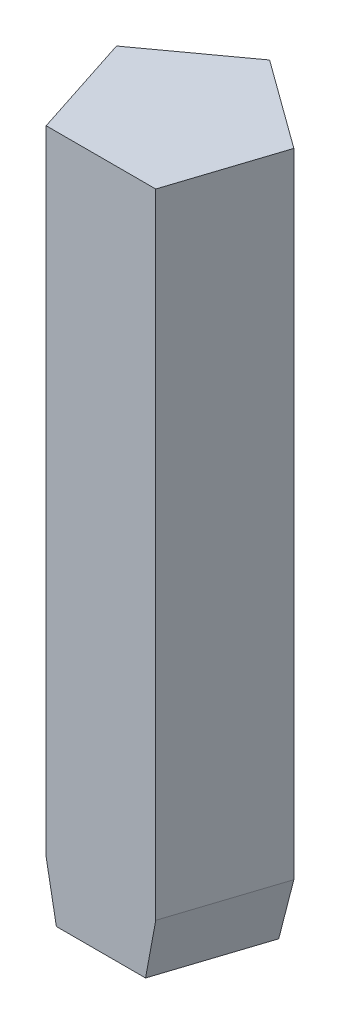
from build123d import *
from OCP.BRepFilletAPI import BRepFilletAPI_MakeChamfer

# Parameters (mm, degrees)
BOSS_EXTRUDE1_DEPTH = 50
CHAMFER1_SIZE       = 4
CHAMFER1_SIZE2      = 0.705307923


with BuildPart() as part:
    # Sketch1 → Boss-Extrude1 (new body)
    with BuildSketch(Plane(origin=(0, 0, 0), x_dir=(1, 0, 0), z_dir=(0, 1, 0))):
        Polygon((0, 6.771180434), (-6.439775275, 2.092409826), (-3.98, -5.478000043), (3.98, -5.478000043), (6.439775275, 2.092409826), align=None)
    extrude(amount=BOSS_EXTRUDE1_DEPTH)

    # Chamfer1: one chamfer whose edges measure the first distance from different faces: ONE call of the kernel's chamfer builder (chamfer() names one face for all edges)
    chamfer1_edges_1 = [part.edges().sort_by_distance(p)[0] for p in [
        (5.209887638, 0, 1.692795109),
    ]]
    chamfer1_side_1 = [part.faces().sort_by_distance(p)[0] for p in [
        (5.209887638, 25, 1.692795109),
    ]]
    chamfer1_edges_2 = [part.edges().sort_by_distance(p)[0] for p in [
        (-5.209887638, 0, 1.692795109),
    ]]
    chamfer1_side_2 = [part.faces().sort_by_distance(p)[0] for p in [
        (-5.209887638, 25, 1.692795109),
    ]]
    chamfer1_edges_3 = [part.edges().sort_by_distance(p)[0] for p in [
        (-3.219887638, 0, -4.43179513),
    ]]
    chamfer1_side_3 = [part.faces().sort_by_distance(p)[0] for p in [
        (-3.219887638, 25, -4.43179513),
    ]]
    chamfer1_edges_4 = [part.edges().sort_by_distance(p)[0] for p in [
        (3.219887638, 0, -4.43179513),
    ]]
    chamfer1_side_4 = [part.faces().sort_by_distance(p)[0] for p in [
        (3.219887638, 25, -4.43179513),
    ]]
    chamfer1 = BRepFilletAPI_MakeChamfer(part.part.solid().wrapped)
    for e in chamfer1_edges_1:
        chamfer1.Add(CHAMFER1_SIZE, CHAMFER1_SIZE2, e.wrapped, chamfer1_side_1[0].wrapped)  # the first distance lies on this face
    for e in chamfer1_edges_2:
        chamfer1.Add(CHAMFER1_SIZE, CHAMFER1_SIZE2, e.wrapped, chamfer1_side_2[0].wrapped)  # the first distance lies on this face
    for e in chamfer1_edges_3:
        chamfer1.Add(CHAMFER1_SIZE, CHAMFER1_SIZE2, e.wrapped, chamfer1_side_3[0].wrapped)  # the first distance lies on this face
    for e in chamfer1_edges_4:
        chamfer1.Add(CHAMFER1_SIZE, CHAMFER1_SIZE2, e.wrapped, chamfer1_side_4[0].wrapped)  # the first distance lies on this face
    add(Compound.cast(chamfer1.Shape()), mode=Mode.REPLACE)


solid = part.part
